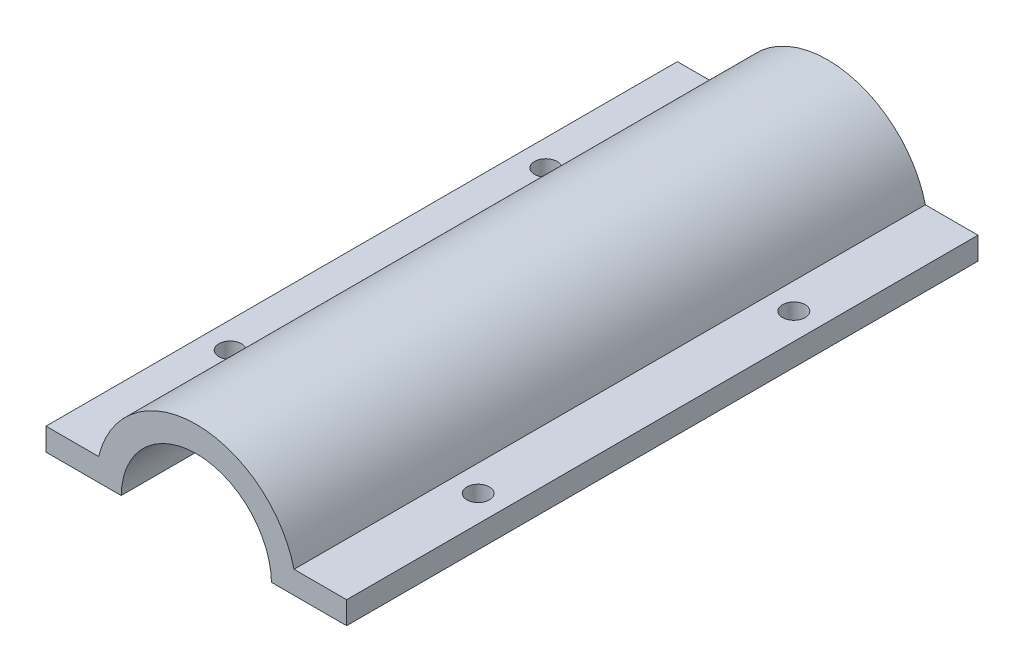
from build123d import *

# Parameters (mm, degrees)
EXTRUDE_1_DEPTH     = 84
SKETCH_2_R          = 1.5
CUT_EXTRUDE_1_DEPTH = 87.948842416


with BuildPart() as part:
    # Эскиз1 → Бобышка-Вытянуть1 (new body)
    with BuildSketch(Plane.XY):
        with BuildLine():
            Line((-9.998476952, 0.174524064), (-19.998476952, 0.174524064))
            Line((-19.998476952, 0.174524064), (-19.998476952, 3.174524064))
            Line((-19.998476952, 3.174524064), (-12.998476952, 3.174524064))
            ThreePointArc((-12.998476952, 3.174524064), (0, 13.380508439), (12.998476952, 3.174524064))
            Line((12.998476952, 3.174524064), (19.998476952, 3.174524064))
            Line((19.998476952, 3.174524064), (19.998476952, 0.174524064))
            Line((19.998476952, 0.174524064), (9.998476952, 0.174524064))
            ThreePointArc((9.998476952, 0.174524064), (7.009092643, 7.132504492), (0, 10))
            ThreePointArc((0, 10), (-7.009092643, 7.132504492), (-9.998476952, 0.174524064))
        make_face()
    extrude(amount=EXTRUDE_1_DEPTH)

    # Эскиз2 → Вырез-Вытянуть1 (cut, through all)
    with BuildSketch(Plane(origin=(0, 3.174524064, 0), x_dir=(1, 0, 0), z_dir=(0, 1, 0))):
        with Locations(Location((-16.498476952, -21, 0), (0, 0, 270))):
            Circle(SKETCH_2_R)
        with Locations(Location((-16.498476952, -63, 0), (0, 0, 270))):
            Circle(SKETCH_2_R)
        with Locations(Location((16.498476952, -21, 0), (0, 0, 270))):
            Circle(SKETCH_2_R)
        with Locations(Location((16.498476952, -63, 0), (0, 0, 270))):
            Circle(SKETCH_2_R)
    extrude(amount=-CUT_EXTRUDE_1_DEPTH, mode=Mode.SUBTRACT)


solid = part.part
